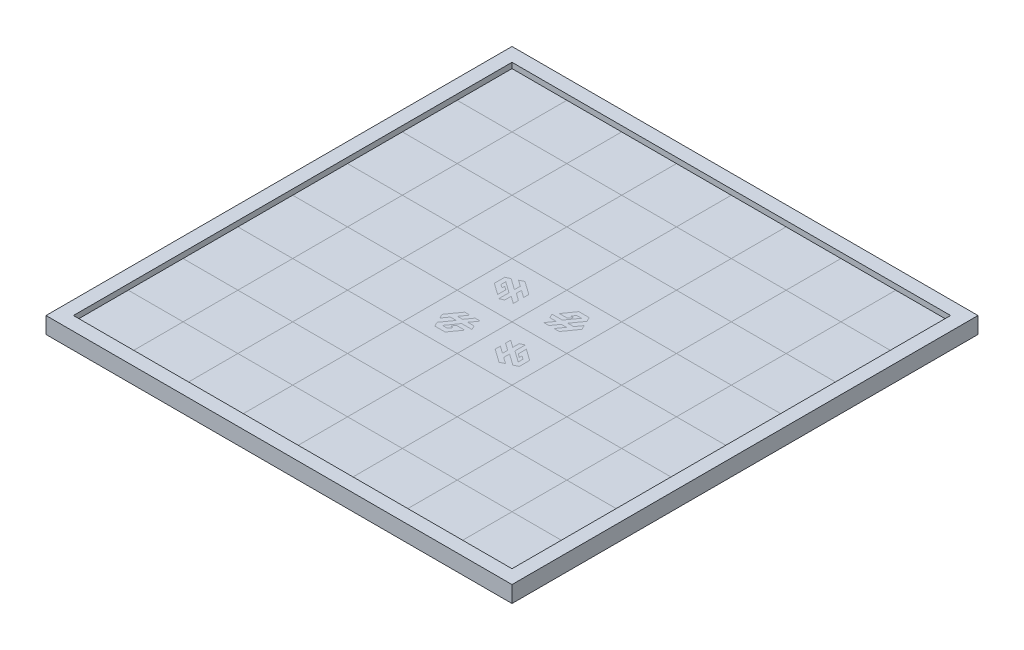
from build123d import *

# Parameters (mm, degrees)
SKETCH1_W           = 203.2
SKETCH1_H           = 203.2
BOSS_EXTRUDE1_DEPTH = 5.08
SKETCH2_W           = 215.9
SKETCH2_H           = 215.9
SKETCH2_W_2         = 203.2
SKETCH2_H_2         = 203.2
BOSS_EXTRUDE2_DEPTH = 7.62


with BuildPart() as part:
    # Sketch1 → Boss-Extrude1 (new body)
    with BuildSketch(Plane(origin=(0, 0, 0), x_dir=(1, 0, 0), z_dir=(0, 1, 0))):
        with Locations((88.9, 88.9)):
            Rectangle(SKETCH1_W, SKETCH1_H)
    extrude(amount=BOSS_EXTRUDE1_DEPTH)

    # Sketch2 → Boss-Extrude2 (add)
    with BuildSketch(Plane.XZ):
        with Locations((88.9, -88.9)):
            Rectangle(SKETCH2_W, SKETCH2_H)
        with Locations((88.9, -88.9)):
            Rectangle(SKETCH2_W_2, SKETCH2_H_2, mode=Mode.SUBTRACT)
    extrude(amount=-BOSS_EXTRUDE2_DEPTH)


solid = part.part
